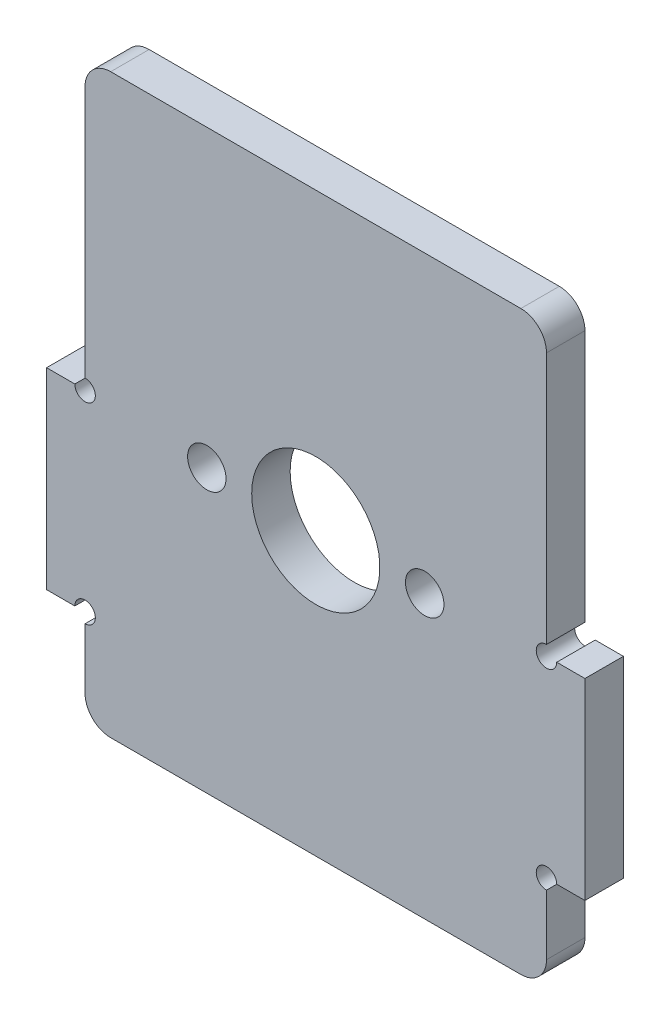
from build123d import *

# Parameters (mm, degrees)
SKETCH1_W           = 3
SKETCH1_H           = 15
BOSS_EXTRUDE1_DEPTH = 3
SKETCH3_W           = 36
SKETCH3_H           = 15
BOSS_EXTRUDE2_DEPTH = 3
SKETCH4_R           = 5
SKETCH4_R_2         = 1.5
CUT_EXTRUDE1_DEPTH  = 37.742346142
SKETCH5_R           = 0.8
CUT_EXTRUDE2_DEPTH  = 37.742346142
FILLET1_R           = 2


with BuildPart() as part:
    # Sketch1 → Boss-Extrude1 (new body)
    with BuildSketch(Plane.XY):
        Polygon((-18, -7.5), (-18, -15), (18, -15), (18, -7.5), (15, -7.5), (15, 7.5), (18, 7.5), (18, 15), (-18, 15), (-18, 7.5), (-15, 7.5), (-15, -7.5), align=None)
        with Locations((-19.5, 0)):
            Rectangle(SKETCH1_W, SKETCH1_H)
        with Locations((-16.5, 0)):
            Rectangle(SKETCH1_W, SKETCH1_H)
        with Locations((19.5, 0)):
            Rectangle(SKETCH1_W, SKETCH1_H)
        with Locations((16.5, 0)):
            Rectangle(SKETCH1_W, SKETCH1_H)
    extrude(amount=BOSS_EXTRUDE1_DEPTH)

    # Sketch3 → Boss-Extrude2 (add)
    with BuildSketch(Plane(origin=(0, 0, 0), x_dir=(-1, 0, 0), z_dir=(0, 0, -1))):
        with Locations((0, 22.5)):
            Rectangle(SKETCH3_W, SKETCH3_H)
    extrude(amount=-BOSS_EXTRUDE2_DEPTH)

    # Sketch4 → Cut-Extrude1 (cut, through all)
    with BuildSketch(Plane(origin=(0, 0, 0), x_dir=(-1, 0, 0), z_dir=(0, 0, -1))):
        with Locations((0, 7)):
            Circle(SKETCH4_R)
        with Locations((-8.5, 7)):
            Circle(SKETCH4_R_2)
        with Locations(Location((8.5, 7, 0), (0, 0, 180))):
            Circle(SKETCH4_R_2)
    extrude(amount=-CUT_EXTRUDE1_DEPTH, mode=Mode.SUBTRACT)

    # Sketch5 → Cut-Extrude2 (cut, through all)
    with BuildSketch(Plane(origin=(0, 0, 0), x_dir=(-1, 0, 0), z_dir=(0, 0, -1))):
        with Locations((-18, 7.5)):
            Circle(SKETCH5_R)
        with Locations((-18, -7.5)):
            Circle(SKETCH5_R)
        with Locations((18, 7.5)):
            Circle(SKETCH5_R)
        with Locations((18, -7.5)):
            Circle(SKETCH5_R)
    extrude(amount=-CUT_EXTRUDE2_DEPTH, mode=Mode.SUBTRACT)

    # Fillet1
    fillet1_edges = [part.edges().sort_by_distance(p)[0] for p in [
        (18, -15, 1.5),
        (-18, -15, 1.5),
        (-18, 30, 1.5),
        (18, 30, 1.5),
    ]]
    fillet(fillet1_edges, radius=FILLET1_R)


solid = part.part
